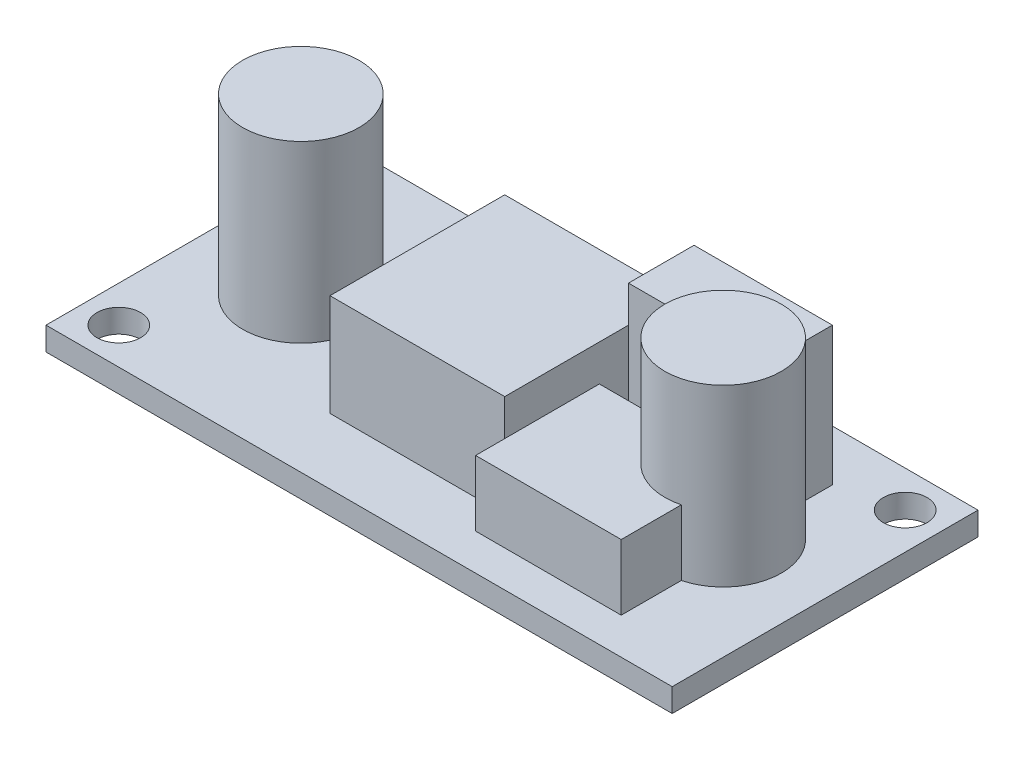
from build123d import *

# Parameters (mm, degrees)
SKETCH1_W               = 43
SKETCH1_H               = 21
PCB_DEPTH               = 1.6
MOUNT_HOLE_1_DEPTH      = 48.880685041
MOUNT_HOLE_1_DEPTH_BACK = 48.880685041
SKETCH2_R               = 1.5
MOUNT_HOLE_2_DEPTH      = 48.880685041
MOUNT_HOLE_2_DEPTH_BACK = 48.880685041
SKETCH3_R               = 1.5
INDUCTOR_START          = 1.6
SKETCH4_W               = 12
SKETCH4_H               = 12
INDUCTOR_DEPTH          = 7
CAP_IN_START            = 1.6
SKETCH5_R               = 4
CAP_IN_DEPTH            = 12
CAP_OUT_START           = 1.6
SKETCH6_R               = 4
CAP_OUT_DEPTH           = 12
TRIM_POT_START          = 1.6
SKETCH7_W               = 9.5
SKETCH7_H               = 4.5
TRIM_POT_DEPTH          = 9.5
LM2596S_START           = 1.6
SKETCH8_W               = 10
SKETCH8_H               = 8.5
LM2596S_DEPTH           = 4.5


with BuildPart() as part:
    # Sketch1 → PCB (new body)
    with BuildSketch(Plane(origin=(0, 0, 0), x_dir=(1, 0, 0), z_dir=(0, 1, 0))):
        with Locations((21.5, 10.5)):
            Rectangle(SKETCH1_W, SKETCH1_H)
    extrude(amount=PCB_DEPTH)

    # Sketch2 → Mount_hole_1 (cut, two sides: drawn at the far end of the back side and taken through both)
    with BuildSketch(Plane(origin=(0, 0, 0), x_dir=(1, 0, 0), z_dir=(0, 1, 0)).offset(-MOUNT_HOLE_1_DEPTH_BACK)):
        with Locations(Location((2.5, 2.5, 0), (0, 0, 270))):
            Circle(SKETCH2_R)
    extrude(amount=MOUNT_HOLE_1_DEPTH + MOUNT_HOLE_1_DEPTH_BACK, mode=Mode.SUBTRACT)

    # Sketch3 → Mount_hole_2 (cut, two sides: drawn at the far end of the back side and taken through both)
    with BuildSketch(Plane(origin=(0, 0, 0), x_dir=(1, 0, 0), z_dir=(0, 1, 0)).offset(-MOUNT_HOLE_2_DEPTH_BACK)):
        with Locations(Location((40.5, 18.5, 0), (0, 0, 270))):
            Circle(SKETCH3_R)
    extrude(amount=MOUNT_HOLE_2_DEPTH + MOUNT_HOLE_2_DEPTH_BACK, mode=Mode.SUBTRACT)

    # Sketch4 → Inductor (add)
    with BuildSketch(Plane(origin=(0, 0, 0), x_dir=(1, 0, 0), z_dir=(0, 1, 0)).offset(INDUCTOR_START)):
        with Locations((21, 10.5)):
            Rectangle(SKETCH4_W, SKETCH4_H)
    extrude(amount=INDUCTOR_DEPTH)

    # Sketch5 → Cap_in (add)
    with BuildSketch(Plane(origin=(0, 0, 0), x_dir=(1, 0, 0), z_dir=(0, 1, 0)).offset(CAP_IN_START)):
        with Locations(Location((7, 10.5, 0), (0, 0, 90))):
            Circle(SKETCH5_R)
    extrude(amount=CAP_IN_DEPTH)

    # Sketch6 → Cap_out (add)
    with BuildSketch(Plane(origin=(0, 0, 0), x_dir=(1, 0, 0), z_dir=(0, 1, 0)).offset(CAP_OUT_START)):
        with Locations(Location((36, 10.5, 0), (0, 0, 90))):
            Circle(SKETCH6_R)
    extrude(amount=CAP_OUT_DEPTH)

    # Sketch7 → Trim_pot (add)
    with BuildSketch(Plane(origin=(0, 0, 0), x_dir=(1, 0, 0), z_dir=(0, 1, 0)).offset(TRIM_POT_START)):
        with Locations((31.75, 15.25)):
            Rectangle(SKETCH7_W, SKETCH7_H)
    extrude(amount=TRIM_POT_DEPTH)

    # Sketch8 → LM2596S (add)
    with BuildSketch(Plane(origin=(0, 0, 0), x_dir=(1, 0, 0), z_dir=(0, 1, 0)).offset(LM2596S_START)):
        with Locations((32, 6.75)):
            Rectangle(SKETCH8_W, SKETCH8_H)
    extrude(amount=LM2596S_DEPTH)


solid = part.part
